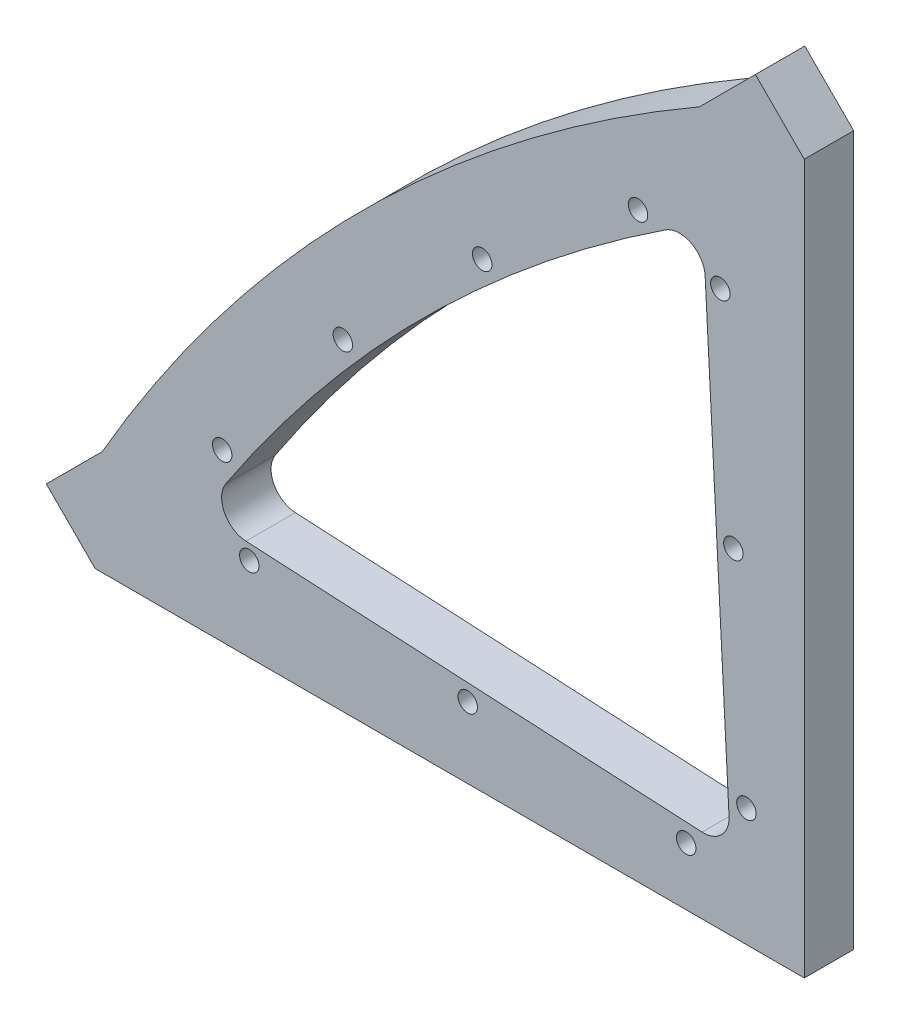
from build123d import *

# Parameters (mm, degrees)
BOSS_EXTRUDE1_DEPTH = 12.7
CUT_EXTRUDE1_DEPTH  = 164.974925036
SKETCH3_R           = 2.5
CUT_EXTRUDE2_DEPTH  = 164.974925036


with BuildPart() as part:
    # Sketch1 → Boss-Extrude1 (new body)
    with BuildSketch(Plane.XY):
        with BuildLine():
            Line((-60.262418021, -86.089619685), (122.036781237, -86.089619685))
            Line((122.036781237, -86.089619685), (122.036781237, 96.209579573))
            Line((122.036781237, 96.209579573), (109.464422667, 108.781938142))
            Line((109.464422667, 108.781938142), (95.096012874, 94.413528349))
            ThreePointArc((95.096012874, 94.413528349), (8.18551326, 27.761648291), (-58.466366797, -59.148851322))
            Line((-58.466366797, -59.148851322), (-72.83477659, -73.517261115))
            Line((-72.83477659, -73.517261115), (-60.262418021, -86.089619685))
        make_face()
    extrude(amount=BOSS_EXTRUDE1_DEPTH)

    # Sketch2 → Cut-Extrude1 (cut, through all)
    with BuildSketch(Plane.XY.offset(12.7)):
        with BuildLine():
            Line((96.548355206, 57.447236553), (102.693314786, -59.805577132))
            ThreePointArc((102.693314786, -59.805577132), (100.768098522, -64.82093697), (95.752738684, -66.746153234))
            Line((95.752738684, -66.746153234), (-21.500075001, -60.601193655))
            ThreePointArc((-21.500075001, -60.601193655), (-27.048234767, -56.985522244), (-26.669858487, -50.374018034))
            ThreePointArc((-26.669858487, -50.374018034), (24.070759008, 11.876402544), (86.321179585, 62.617020039))
            ThreePointArc((86.321179585, 62.617020039), (92.932683796, 62.995396319), (96.548355206, 57.447236553))
        make_face()
    extrude(amount=-CUT_EXTRUDE1_DEPTH, mode=Mode.SUBTRACT)

    # Sketch3 → Cut-Extrude2 (cut, through all)
    with BuildSketch(Plane(origin=(0, 0, 0), x_dir=(-1, 0, 0), z_dir=(0, 0, -1))):
        with Locations((-100.449569709, 56.599670194)):
            Circle(SKETCH3_R)
        with Locations((-79.287603593, 63.568690871)):
            Circle(SKETCH3_R)
        with Locations((-39.228116315, 32.54613876)):
            Circle(SKETCH3_R)
        with Locations((-3.401022792, -3.280954763)):
            Circle(SKETCH3_R)
        with Locations((27.621529319, -43.340442042)):
            Circle(SKETCH3_R)
        with Locations((20.652508642, -64.502408157)):
            Circle(SKETCH3_R)
        with Locations((-35.508445898, -67.856108518)):
            Circle(SKETCH3_R)
        with Locations((-91.669400439, -71.209808879)):
            Circle(SKETCH3_R)
        with Locations((-107.156970431, -55.722238887)):
            Circle(SKETCH3_R)
        with Locations((-103.80327007, 0.438715653)):
            Circle(SKETCH3_R)
    extrude(amount=-CUT_EXTRUDE2_DEPTH, mode=Mode.SUBTRACT)


solid = part.part
